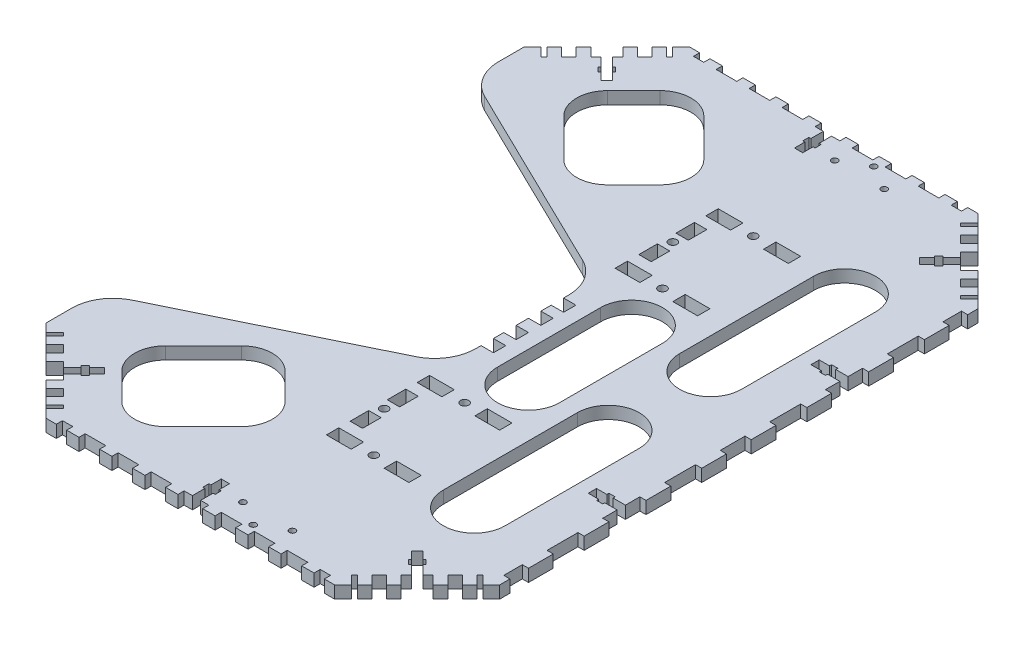
from build123d import *

# Parameters (mm, degrees)
ESQUISSE1_W              = 220
ESQUISSE1_H              = 312
BOSS_EXTRU_1_DEPTH       = 6
ESQUISSE2_R              = 2
ESQUISSE2_R_2            = 1.5
ESQUISSE2_W              = 12
ESQUISSE2_H              = 6
ENL_V_MAT_EXTRU_1_DEPTH  = 264.372387569
ENL_V_MAT_EXTRU_2_DEPTH  = 264.372387569
CONG_1_R                 = 20
CONG_2_R                 = 40
ENL_V_MAT_EXTRU_3_DEPTH  = 6
ENL_V_MAT_EXTRU_6_DEPTH  = 6
ENL_V_MAT_EXTRU_7_DEPTH  = 264.372387569
CONG_3_R                 = 15
ESQUISSE9_W              = 12
ESQUISSE9_H              = 3
ESQUISSE9_W_2            = 10
ESQUISSE9_W_3            = 5
ENL_V_MAT_EXTRU_8_DEPTH  = 6
ENL_V_MAT_EXTRU_9_DEPTH  = 6
SYM_TRIE1_COPY_1_DEPTH   = 6
SYM_TRIE1_COPY_2_DEPTH   = 6
CONG_3_OF_SYM_TRIE1_R    = 15
ESQUISSE5_R              = 2
ESQUISSE5_W              = 6
ESQUISSE5_H              = 6
ESQUISSE5_H_2            = 9
ENL_V_MAT_EXTRU_4_DEPTH  = 6
ENL_V_MAT_EXTRU_5_DEPTH  = 6
ESQUISSE11_W             = 3
ESQUISSE11_H             = 9
ESQUISSE11_H_2           = 12
ESQUISSE11_H_3           = 15
ESQUISSE11_H_4           = 18
ENL_V_MAT_EXTRU_10_DEPTH = 6
ENL_V_MAT_EXTRU_11_DEPTH = 6


with BuildPart() as part:
    # Esquisse1 → Boss.-Extru.1 (new body)
    with BuildSketch(Plane(origin=(0, 0, 0), x_dir=(1, 0, 0), z_dir=(0, 1, 0))):
        with Locations((-27.578539427, -68.502026769)):
            Rectangle(ESQUISSE1_W, ESQUISSE1_H)
    extrude(amount=BOSS_EXTRU_1_DEPTH)

    # Esquisse2 → Enlèv. mat.-Extru.1 (cut, through all)
    with BuildSketch(Plane(origin=(0, 6, 0), x_dir=(1, 0, 0), z_dir=(0, 1, 0))):
        with Locations(Location((-2.578539427, -116.502026769, 0), (0, 0, 270))):
            Circle(ESQUISSE2_R)
        with Locations(Location((-2.578539427, -160.502026769, 0), (0, 0, 90))):
            Circle(ESQUISSE2_R)
        with Locations(Location((-2.578539427, 23.497973231, 0), (0, 0, 270))):
            Circle(ESQUISSE2_R)
        with Locations(Location((-2.578539427, -20.502026769, 0), (0, 0, 90))):
            Circle(ESQUISSE2_R)
        with Locations(Location((-14.578539427, -212.002026769, 0), (0, 0, 270))):
            Circle(ESQUISSE2_R_2)
        with Locations(Location((-2.578539427, -219.002026769, 0), (0, 0, 270))):
            Circle(ESQUISSE2_R_2)
        with Locations(Location((9.421460573, -212.002026769, 0), (0, 0, 270))):
            Circle(ESQUISSE2_R_2)
        with Locations(Location((9.421460573, 74.997973231, 0), (0, 0, 90))):
            Circle(ESQUISSE2_R_2)
        with Locations(Location((-2.578539427, 81.997973231, 0), (0, 0, 90))):
            Circle(ESQUISSE2_R_2)
        with Locations(Location((-14.578539427, 74.997973231, 0), (0, 0, 90))):
            Circle(ESQUISSE2_R_2)
        with Locations((-16.578539427, -116.502026769)):
            Rectangle(ESQUISSE2_W, ESQUISSE2_H)
        with Locations((11.421460573, -116.502026769)):
            Rectangle(ESQUISSE2_W, ESQUISSE2_H)
        with Locations((11.421460573, -160.502026769)):
            Rectangle(ESQUISSE2_W, ESQUISSE2_H)
        with Locations((-16.578539427, -160.502026769)):
            Rectangle(ESQUISSE2_W, ESQUISSE2_H)
        with Locations((-16.578539427, 23.497973231)):
            Rectangle(ESQUISSE2_W, ESQUISSE2_H)
        with Locations((11.421460573, 23.497973231)):
            Rectangle(ESQUISSE2_W, ESQUISSE2_H)
        with Locations((11.421460573, -20.502026769)):
            Rectangle(ESQUISSE2_W, ESQUISSE2_H)
        with Locations((-16.578539427, -20.502026769)):
            Rectangle(ESQUISSE2_W, ESQUISSE2_H)
    extrude(amount=-ENL_V_MAT_EXTRU_1_DEPTH, mode=Mode.SUBTRACT)

    # Esquisse3 → Enlèv. mat.-Extru.2 (cut, through all)
    with BuildSketch(Plane(origin=(0, 6, 0), x_dir=(1, 0, 0), z_dir=(0, 1, 0))):
        Polygon((-137.578539427, 22.497973231), (-22.578539427, -33.502026769), (-22.578539427, -103.502026769), (-137.578539427, -159.502026769), align=None)
    extrude(amount=-ENL_V_MAT_EXTRU_2_DEPTH, mode=Mode.SUBTRACT)

    # Congé1
    cong_1_edges = [part.edges().sort_by_distance(p)[0] for p in [
        (-137.578539427, 3, 159.502026769),
        (-137.578539427, 3, -22.497973231),
        (-22.578539427, 3, 33.502026769),
        (-22.578539427, 3, 103.502026769),
    ]]
    fillet(cong_1_edges, radius=CONG_1_R)

    # Congé2
    cong_2_edges = [part.edges().sort_by_distance(p)[0] for p in [
        (-137.578539427, 3, -87.497973231),
        (82.421460573, 3, -87.497973231),
        (82.421460573, 3, 224.502026769),
        (-137.578539427, 3, 224.502026769),
    ]]
    fillet(cong_2_edges, radius=CONG_2_R)

    # Esquisse4 → Enlèv. mat.-Extru.3 (cut)
    with BuildSketch(Plane(origin=(0, 6, 0), x_dir=(1, 0, 0), z_dir=(0, 1, 0))):
        with BuildLine():
            Line((-137.578539427, -184.502026769), (-97.578539427, -224.502026769))
            ThreePointArc((-97.578539427, -224.502026769), (-125.862810674, -212.786298016), (-137.578539427, -184.502026769))
        make_face()
    enl_v_mat_extru_3 = extrude(amount=-ENL_V_MAT_EXTRU_3_DEPTH, mode=Mode.SUBTRACT)

    # Esquisse7 → Enlèv. mat.-Extru.6 (cut)
    with BuildSketch(Plane(origin=(0, 6, 0), x_dir=(1, 0, 0), z_dir=(0, 1, 0))):
        Polygon((-114.750112302, -198.845172519), (-110.507471615, -194.602531832), (-111.214578396, -193.895425051), (-109.093258052, -191.774104707), (-108.386151271, -192.481211488), (-104.850617365, -188.945677582), (-102.02219024, -191.774104707), (-105.557724146, -195.309638613), (-104.850617365, -196.016745394), (-106.971937709, -198.138065738), (-107.67904449, -197.430958957), (-111.921685177, -201.673599644), (-109.446811443, -204.148473378), (-113.68945213, -208.391114065), (-121.467626723, -200.612939472), (-117.224986036, -196.370298785), align=None)
        Polygon((-125.003160629, -197.077405566), (-128.538694535, -193.54187166), (-124.296053848, -189.299230973), (-120.760519942, -192.834764879), align=None)
        Polygon((-110.153918224, -211.926647971), (-106.618384318, -215.462181877), (-102.375743631, -211.21954119), (-105.911277537, -207.684007284), align=None)
        Polygon((-101.66863685, -220.411929345), (-103.082850412, -218.997715783), (-98.840209725, -214.755075096), (-97.425996163, -216.169288658), align=None)
        Polygon((-132.074228441, -190.006337754), (-133.488442003, -188.592124192), (-129.245801316, -184.349483505), (-127.831587754, -185.763697067), align=None)
    enl_v_mat_extru_6 = extrude(amount=-ENL_V_MAT_EXTRU_6_DEPTH, mode=Mode.SUBTRACT)

    # Esquisse8 → Enlèv. mat.-Extru.7 (cut, through all)
    with BuildSketch(Plane(origin=(0, 6, 0), x_dir=(1, 0, 0), z_dir=(0, 1, 0))):
        Polygon((-75.678650912, -209.632362661), (-109.619776409, -175.691237164), (-70.021796663, -136.093257418), (-36.080671166, -170.034382915), align=None)
    enl_v_mat_extru_7 = extrude(amount=-ENL_V_MAT_EXTRU_7_DEPTH, mode=Mode.SUBTRACT)

    # Congé3
    cong_3_edges = [part.edges().sort_by_distance(p)[0] for p in [
        (-36.080671166, 3, 170.034382915),
        (-75.678650912, 3, 209.632362661),
        (-109.619776409, 3, 175.691237164),
        (-70.021796663, 3, 136.093257418),
    ]]
    fillet(cong_3_edges, radius=CONG_3_R)

    # Esquisse9 → Enlèv. mat.-Extru.8 (cut)
    with BuildSketch(Plane(origin=(0, 6, 0), x_dir=(1, 0, 0), z_dir=(0, 1, 0))):
        with Locations((-27.578539427, -223.002026769)):
            Rectangle(ESQUISSE9_W, ESQUISSE9_H)
        with Locations((-44.578539427, -223.002026769)):
            Rectangle(ESQUISSE9_W_2, ESQUISSE9_H)
        with Locations((-60.578539427, -223.002026769)):
            Rectangle(ESQUISSE9_W_2, ESQUISSE9_H)
        with Locations((-76.578539427, -223.002026769)):
            Rectangle(ESQUISSE9_W_2, ESQUISSE9_H)
        with Locations((-90.078539427, -223.002026769)):
            Rectangle(ESQUISSE9_W_3, ESQUISSE9_H)
        with Locations((-10.578539427, -223.002026769)):
            Rectangle(ESQUISSE9_W_2, ESQUISSE9_H)
        with Locations((5.421460573, -223.002026769)):
            Rectangle(ESQUISSE9_W_2, ESQUISSE9_H)
        with Locations((21.421460573, -223.002026769)):
            Rectangle(ESQUISSE9_W_2, ESQUISSE9_H)
        with Locations((34.921460573, -223.002026769)):
            Rectangle(ESQUISSE9_W_3, ESQUISSE9_H)
    enl_v_mat_extru_8 = extrude(amount=-ENL_V_MAT_EXTRU_8_DEPTH, mode=Mode.SUBTRACT)

    # Esquisse10 → Enlèv. mat.-Extru.9 (cut)
    with BuildSketch(Plane(origin=(0, 6, 0), x_dir=(1, 0, 0), z_dir=(0, 1, 0))):
        Polygon((-29.578539427, -207.502026769), (-25.578539427, -207.502026769), (-25.578539427, -212.502026769), (-24.578539427, -212.502026769), (-24.578539427, -215.502026769), (-25.578539427, -215.502026769), (-25.578539427, -221.502026769), (-29.578539427, -221.502026769), (-29.578539427, -215.502026769), (-30.578539427, -215.502026769), (-30.578539427, -212.502026769), (-29.578539427, -212.502026769), align=None)
    enl_v_mat_extru_9 = extrude(amount=-ENL_V_MAT_EXTRU_9_DEPTH, mode=Mode.SUBTRACT)

    # Symétrie3: Enlèv. mat.-Extru.3, Enlèv. mat.-Extru.6 across plane
    add(enl_v_mat_extru_3.mirror(Plane.ZY.offset(27.578539427)), mode=Mode.SUBTRACT)
    add(enl_v_mat_extru_6.mirror(Plane.ZY.offset(27.578539427)), mode=Mode.SUBTRACT)

    # Symétrie1: Enlèv. mat.-Extru.3, Enlèv. mat.-Extru.6, Enlèv. mat.-Extru.7, Enlèv. mat.-Extru.8, Enlèv. mat.-Extru.9 across plane
    add(enl_v_mat_extru_3.mirror(Plane.XY.offset(68.502026769)), mode=Mode.SUBTRACT)
    add(enl_v_mat_extru_6.mirror(Plane.XY.offset(68.502026769)), mode=Mode.SUBTRACT)
    add(enl_v_mat_extru_7.mirror(Plane.XY.offset(68.502026769)), mode=Mode.SUBTRACT)
    add(enl_v_mat_extru_8.mirror(Plane.XY.offset(68.502026769)), mode=Mode.SUBTRACT)
    add(enl_v_mat_extru_9.mirror(Plane.XY.offset(68.502026769)), mode=Mode.SUBTRACT)

    # Symétrie1 copy 1 sketch → Symétrie1 copy 1 (cut)
    with BuildSketch(Plane(origin=(-55.157078853, 6, 137.004053537), x_dir=(-1, 0, 0), z_dir=(0, 1, 0))):
        with BuildLine():
            Line((-137.578539427, -184.502026769), (-97.578539427, -224.502026769))
            ThreePointArc((-97.578539427, -224.502026769), (-125.862810674, -212.786298016), (-137.578539427, -184.502026769))
        make_face()
    extrude(amount=-SYM_TRIE1_COPY_1_DEPTH, mode=Mode.SUBTRACT)

    # Symétrie1 copy 2 sketch → Symétrie1 copy 2 (cut)
    with BuildSketch(Plane(origin=(-55.157078853, 6, 137.004053537), x_dir=(-1, 0, 0), z_dir=(0, 1, 0))):
        Polygon((-114.750112302, -198.845172519), (-110.507471615, -194.602531832), (-111.214578396, -193.895425051), (-109.093258052, -191.774104707), (-108.386151271, -192.481211488), (-104.850617365, -188.945677582), (-102.02219024, -191.774104707), (-105.557724146, -195.309638613), (-104.850617365, -196.016745394), (-106.971937709, -198.138065738), (-107.67904449, -197.430958957), (-111.921685177, -201.673599644), (-109.446811443, -204.148473378), (-113.68945213, -208.391114065), (-121.467626723, -200.612939472), (-117.224986036, -196.370298785), align=None)
        Polygon((-125.003160629, -197.077405566), (-128.538694535, -193.54187166), (-124.296053848, -189.299230973), (-120.760519942, -192.834764879), align=None)
        Polygon((-110.153918224, -211.926647971), (-106.618384318, -215.462181877), (-102.375743631, -211.21954119), (-105.911277537, -207.684007284), align=None)
        Polygon((-101.66863685, -220.411929345), (-103.082850412, -218.997715783), (-98.840209725, -214.755075096), (-97.425996163, -216.169288658), align=None)
        Polygon((-132.074228441, -190.006337754), (-133.488442003, -188.592124192), (-129.245801316, -184.349483505), (-127.831587754, -185.763697067), align=None)
    extrude(amount=-SYM_TRIE1_COPY_2_DEPTH, mode=Mode.SUBTRACT)

    # Congé3 of Symétrie1
    cong_3_of_sym_trie1_edges = [part.edges().sort_by_distance(p)[0] for p in [
        (-36.080671166, 3, -33.030329378),
        (-75.678650912, 3, -72.628309124),
        (-109.619776409, 3, -38.687183627),
        (-70.021796663, 3, 0.910796119),
    ]]
    fillet(cong_3_of_sym_trie1_edges, radius=CONG_3_OF_SYM_TRIE1_R)

    # Esquisse5 → Enlèv. mat.-Extru.4 (cut)
    with BuildSketch(Plane(origin=(0, 6, 0), x_dir=(1, 0, 0), z_dir=(0, 1, 0))):
        with Locations(Location((-19.578539427, 1.497973231, 0), (0, 0, 270))):
            Circle(ESQUISSE5_R)
        with Locations((-19.578539427, -62.502026769)):
            Rectangle(ESQUISSE5_W, ESQUISSE5_H)
        with Locations((-19.578539427, -51.502026769)):
            Rectangle(ESQUISSE5_W, ESQUISSE5_H)
        with Locations((-19.578539427, -7.502026769)):
            Rectangle(ESQUISSE5_W, ESQUISSE5_H_2)
        with Locations((-19.578539427, 10.497973231)):
            Rectangle(ESQUISSE5_W, ESQUISSE5_H_2)
    enl_v_mat_extru_4 = extrude(amount=-ENL_V_MAT_EXTRU_4_DEPTH, mode=Mode.SUBTRACT)

    # Symétrie2: Enlèv. mat.-Extru.4 across plane
    add(enl_v_mat_extru_4.mirror(Plane.XY.offset(68.502026769)), mode=Mode.SUBTRACT)

    # Esquisse6 → Enlèv. mat.-Extru.5 (cut)
    with BuildSketch(Plane(origin=(0, 6, 0), x_dir=(1, 0, 0), z_dir=(0, 1, 0))):
        with BuildLine():
            Line((-9.578539427, -93.502026769), (-9.578539427, -43.502026769))
            ThreePointArc((-9.578539427, -43.502026769), (5.421460573, -28.502026769), (20.421460573, -43.502026769))
            Line((20.421460573, -43.502026769), (20.421460573, -93.502026769))
            ThreePointArc((20.421460573, -93.502026769), (5.421460573, -108.502026769), (-9.578539427, -93.502026769))
        make_face()
        with BuildLine():
            Line((58.921460573, -93.312544532), (58.921460573, -158.312544532))
            ThreePointArc((58.921460573, -158.312544532), (43.921460573, -173.312544532), (28.921460573, -158.312544532))
            Line((28.921460573, -158.312544532), (28.921460573, -93.312544532))
            ThreePointArc((28.921460573, -93.312544532), (43.921460573, -78.312544532), (58.921460573, -93.312544532))
        make_face()
        with BuildLine():
            Line((28.921460573, -43.691509005), (28.921460573, 21.308490995))
            ThreePointArc((28.921460573, 21.308490995), (43.921460573, 36.308490995), (58.921460573, 21.308490995))
            Line((58.921460573, 21.308490995), (58.921460573, -43.691509005))
            ThreePointArc((58.921460573, -43.691509005), (43.921460573, -58.691509005), (28.921460573, -43.691509005))
        make_face()
    extrude(amount=-ENL_V_MAT_EXTRU_5_DEPTH, mode=Mode.SUBTRACT)

    # Esquisse11 → Enlèv. mat.-Extru.10 (cut)
    with BuildSketch(Plane(origin=(0, 6, 0), x_dir=(1, 0, 0), z_dir=(0, 1, 0))):
        with Locations((80.921460573, 37.997973231)):
            Rectangle(ESQUISSE11_W, ESQUISSE11_H)
        with Locations((80.921460573, -68.502026769)):
            Rectangle(ESQUISSE11_W, ESQUISSE11_H_2)
        with Locations((80.921460573, -94.002026769)):
            Rectangle(ESQUISSE11_W, ESQUISSE11_H_3)
        with Locations((80.921460573, -122.502026769)):
            Rectangle(ESQUISSE11_W, ESQUISSE11_H_4)
        with Locations((80.921460573, -151.002026769)):
            Rectangle(ESQUISSE11_W, ESQUISSE11_H_3)
        with Locations((80.921460573, -175.002026769)):
            Rectangle(ESQUISSE11_W, ESQUISSE11_H)
        with Locations((80.921460573, 13.997973231)):
            Rectangle(ESQUISSE11_W, ESQUISSE11_H_3)
        with Locations((80.921460573, -14.502026769)):
            Rectangle(ESQUISSE11_W, ESQUISSE11_H_4)
        with Locations((80.921460573, -43.002026769)):
            Rectangle(ESQUISSE11_W, ESQUISSE11_H_3)
    extrude(amount=-ENL_V_MAT_EXTRU_10_DEPTH, mode=Mode.SUBTRACT)

    # Esquisse12 → Enlèv. mat.-Extru.11 (cut)
    with BuildSketch(Plane(origin=(0, 6, 0), x_dir=(1, 0, 0), z_dir=(0, 1, 0))):
        Polygon((70.421460573, -120.502026769), (70.421460573, -119.502026769), (73.421460573, -119.502026769), (73.421460573, -120.502026769), (79.421460573, -120.502026769), (79.421460573, -124.502026769), (73.421460573, -124.502026769), (73.421460573, -125.502026769), (70.421460573, -125.502026769), (70.421460573, -124.502026769), (65.421460573, -124.502026769), (65.421460573, -120.502026769), align=None)
        Polygon((73.421460573, -16.502026769), (73.421460573, -17.502026769), (70.421460573, -17.502026769), (70.421460573, -16.502026769), (65.421460573, -16.502026769), (65.421460573, -12.502026769), (70.421460573, -12.502026769), (70.421460573, -11.502026769), (73.421460573, -11.502026769), (73.421460573, -12.502026769), (79.421460573, -12.502026769), (79.421460573, -16.502026769), align=None)
    extrude(amount=-ENL_V_MAT_EXTRU_11_DEPTH, mode=Mode.SUBTRACT)


solid = part.part
